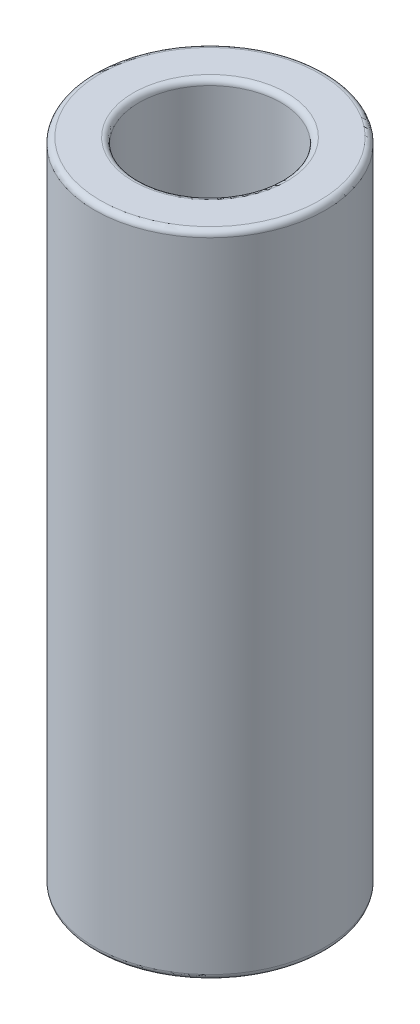
from build123d import *

# Parameters (mm, degrees)
SKETCH1_W = 1.5625
SKETCH1_H = 22.86
FILLET1_R = 0.2


with BuildPart() as part:
    # Sketch1 → Revolve1 (revolve)
    with BuildSketch(Plane.XY, mode=Mode.PRIVATE) as revolve1_sk:
        with Locations((3.28125, 0)):
            Rectangle(SKETCH1_W, SKETCH1_H)
    revolve(revolve1_sk.sketch.rotate(Axis((0, -7.961956522, 0), (0, 1, 0)), 90), axis=Axis((0, -7.961956522, 0), (0, 1, 0)))

    # Fillet1
    fillet1_edges = [part.edges().sort_by_distance(p)[0] for p in [
        (0, 11.43, 2.5),
        (0, 11.43, 4.0625),
        (0, -11.43, 4.0625),
        (0, -11.43, 2.5),
    ]]
    fillet(fillet1_edges, radius=FILLET1_R)


solid = part.part
